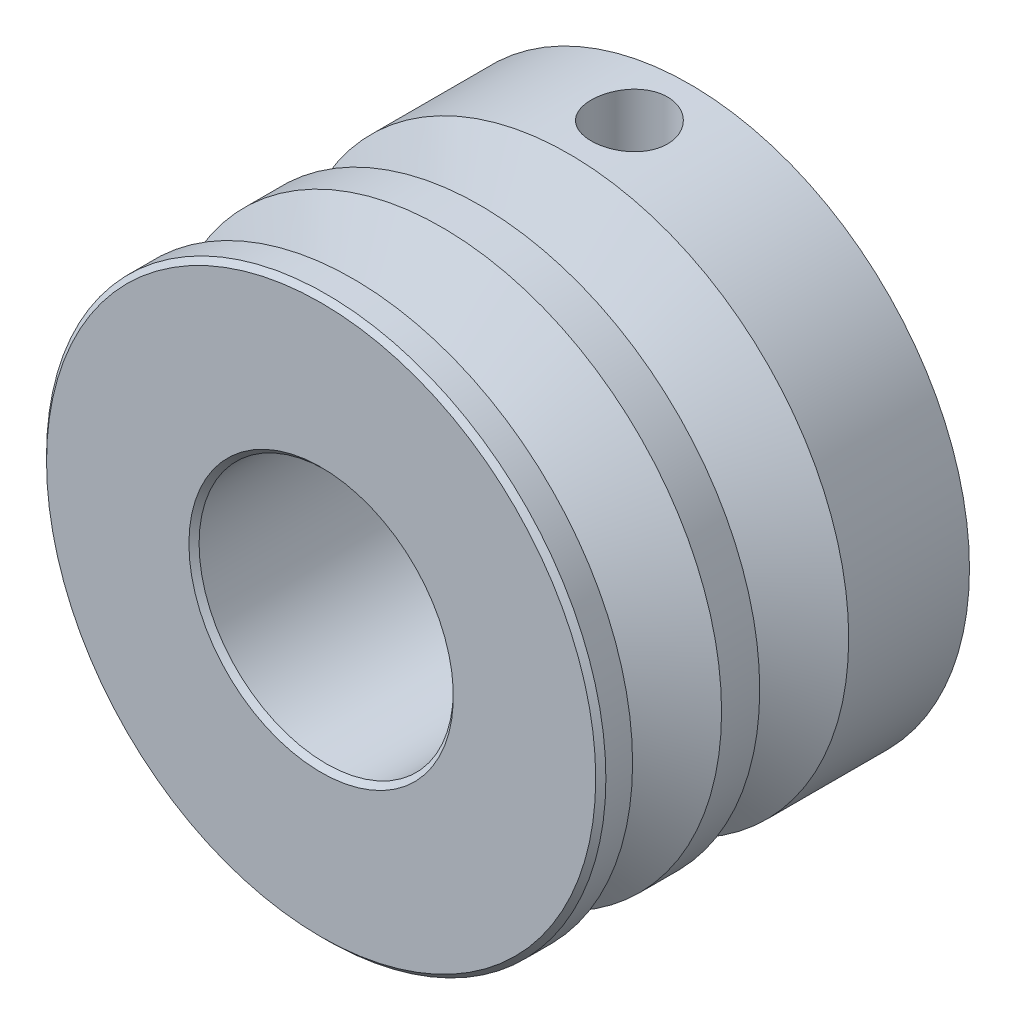
from build123d import *

# Parameters (mm, degrees)
SKETCH_2_W               = 1.5
SKETCH_2_H               = 15.026279442
PATTERN_CIRCULAR_1_COUNT = 2
PATTERN_CIRCULAR_1_ANGLE = 120
CHAMFER_1_SIZE           = 0.2


with BuildPart() as part:
    # 草图1 → 旋转1 (revolve)
    with BuildSketch(Plane(origin=(0, 0, 0), x_dir=(0, 0, -1), z_dir=(1, 0, 0)), mode=Mode.PRIVATE) as revolve_1_sk:
        with BuildLine():
            Line((0, 5), (15, 5))
            Line((15, 5), (15, 6))
            Line((15, 6), (14.5, 6))
            Line((14.5, 6), (14.5, 11))
            Line((14.5, 11), (9.75, 11))
            Line((9.75, 11), (8.08660254, 8.118911087))
            ThreePointArc((8.08660254, 8.118911087), (8, 8.068911087), (7.91339746, 8.118911087))
            Line((7.91339746, 8.118911087), (6.25, 11))
            Line((6.25, 11), (4.75, 11))
            Line((4.75, 11), (3.08660254, 8.118911087))
            ThreePointArc((3.08660254, 8.118911087), (3, 8.068911087), (2.91339746, 8.118911087))
            Line((2.91339746, 8.118911087), (1.25, 11))
            Line((1.25, 11), (0, 11))
            Line((0, 11), (0, 5))
        make_face()
    revolve(revolve_1_sk.sketch.rotate(Axis((0, 0, 0), (0, 0, -1)), 90), axis=Axis((0, 0, 0), (0, 0, -1)))

    # 草图2 → M3 螺纹孔1 (revolve, cut)
    with BuildSketch(Plane(origin=(0, 0, -12.125), x_dir=(0, 0, -1), z_dir=(1, 0, 0))):
        with Locations((0.75, 7.513139721)):
            Rectangle(SKETCH_2_W, SKETCH_2_H)
    hole_wizard_m3_1 = revolve(axis=Axis((0, -6.35, -12.125), (0, 1, 0)), mode=Mode.SUBTRACT)

    # 阵列(圆周)1: M3 螺纹孔1 ×2 about axis
    pattern_circular_1_axis = Axis((0, 0, 0), (0, 0, 1))
    for i in range(1, PATTERN_CIRCULAR_1_COUNT):
        add(hole_wizard_m3_1.rotate(pattern_circular_1_axis, i * PATTERN_CIRCULAR_1_ANGLE / (PATTERN_CIRCULAR_1_COUNT - 1)), mode=Mode.SUBTRACT)

    # 倒角1
    chamfer_1_edges = [part.edges().sort_by_distance(p)[0] for p in [
        (-6, 0, -15),
        (-11, 0, 0),
        (-5, 0, 0),
        (-5, 0, -15),
    ]]
    chamfer(chamfer_1_edges, length=CHAMFER_1_SIZE)


solid = part.part
